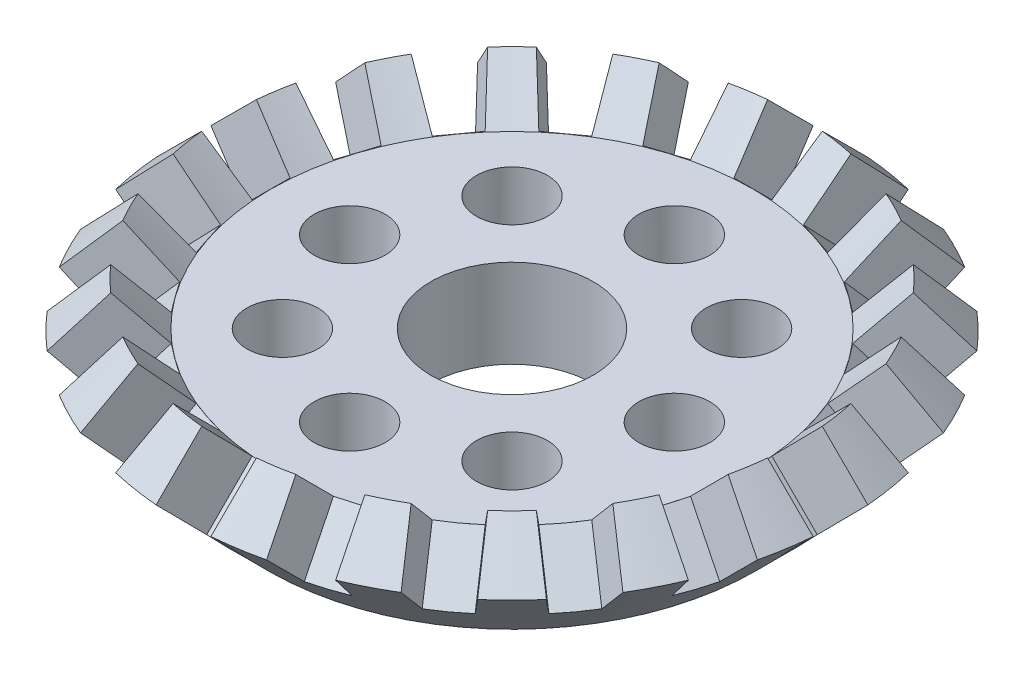
from build123d import *

# Parameters (mm, degrees)
CUT_EXTRUDE11_DEPTH = 10
CUT_EXTRUDE12_DEPTH = 10
SKETCH5_3_R         = 1.75
CUT_EXTRUDE13_DEPTH = 10
CIRPATTERN13_COUNT  = 8
CIRPATTERN14_COUNT  = 20


with BuildPart() as part:
    # Sketch2 → Revolve4 (revolve)
    with BuildSketch(Plane.XY):
        Polygon((0, 0), (0, 4.355813863), (-11.886826824, 4.355813863), (-14.008147168, 6.477134207), (-16.242640687, 4.242640687), (-12, 0), align=None)
    revolve(axis=Axis((0, 0, 0), (0, 1, 0)))

    # Sketch4 → Cut-Extrude11 (cut)
    with BuildSketch(Plane(origin=(-6, -6, 0), x_dir=(0, 0, 1), z_dir=(-0.7071067811865476, -0.7071067811865475, 0))):
        Polygon((-0.933664093, 11.489581742), (0.933664093, 11.489581742), (1.411909827, 14.888208465), (-1.411909827, 14.888208465), align=None)
    cut_extrude11 = extrude(amount=-CUT_EXTRUDE11_DEPTH, mode=Mode.SUBTRACT)

    # Sketch5 → Cut-Extrude12 (cut)
    with BuildSketch(Plane(origin=(0, 4.355813863, 0), x_dir=(1, 0, 0), z_dir=(0, 1, 0))):
        with BuildLine():
            ThreePointArc((4, 0), (-2.828427125, 2.828427125), (0, -4))
            ThreePointArc((0, -4), (2.828427125, -2.828427125), (4, 0))
        make_face()
    extrude(amount=-CUT_EXTRUDE12_DEPTH, mode=Mode.SUBTRACT)

    # Sketch5<3> → Cut-Extrude13 (cut)
    with BuildSketch(Plane(origin=(0, 4.355813863, 0), x_dir=(1, 0, 0), z_dir=(0, 1, 0))):
        with Locations((0, -8)):
            Circle(SKETCH5_3_R)
    cut_extrude13 = extrude(amount=-CUT_EXTRUDE13_DEPTH, mode=Mode.SUBTRACT)

    # CirPattern13: Cut-Extrude13 ×8 about axis
    cirpattern13_axis = Axis((0, 20.485281374, 0), (0, -1, 0))
    for i in range(1, CIRPATTERN13_COUNT):
        add(cut_extrude13.rotate(cirpattern13_axis, i * 360 / CIRPATTERN13_COUNT), mode=Mode.SUBTRACT)

    # CirPattern14: Cut-Extrude11 ×20 about axis
    cirpattern14_axis = Axis((0, 0, 0), (0, 1, 0))
    for i in range(1, CIRPATTERN14_COUNT):
        add(cut_extrude11.rotate(cirpattern14_axis, i * 360 / CIRPATTERN14_COUNT), mode=Mode.SUBTRACT)


solid = part.part
